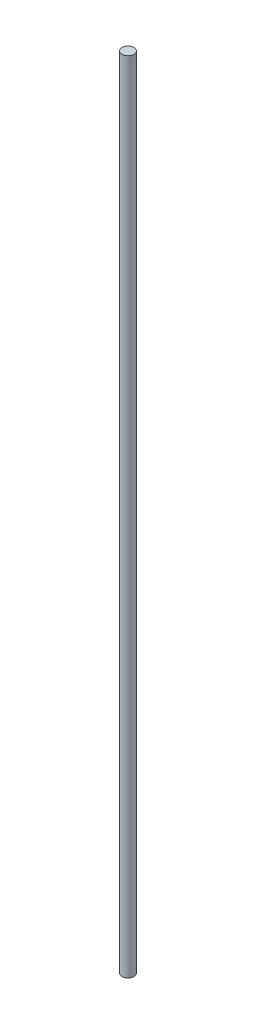
from build123d import *

# Parameters (mm, degrees)
SKETCH_1_R      = 7.5
EXTRUDE_1_DEPTH = 1002


with BuildPart() as part:
    # 스케치1 → 보스-돌출1 (new body)
    with BuildSketch(Plane(origin=(0, 0, 0), x_dir=(1, 0, 0), z_dir=(0, 1, 0))):
        with Locations(Location((0, 0, 0), (0, 0, 270))):
            Circle(SKETCH_1_R)
    extrude(amount=EXTRUDE_1_DEPTH)


solid = part.part
